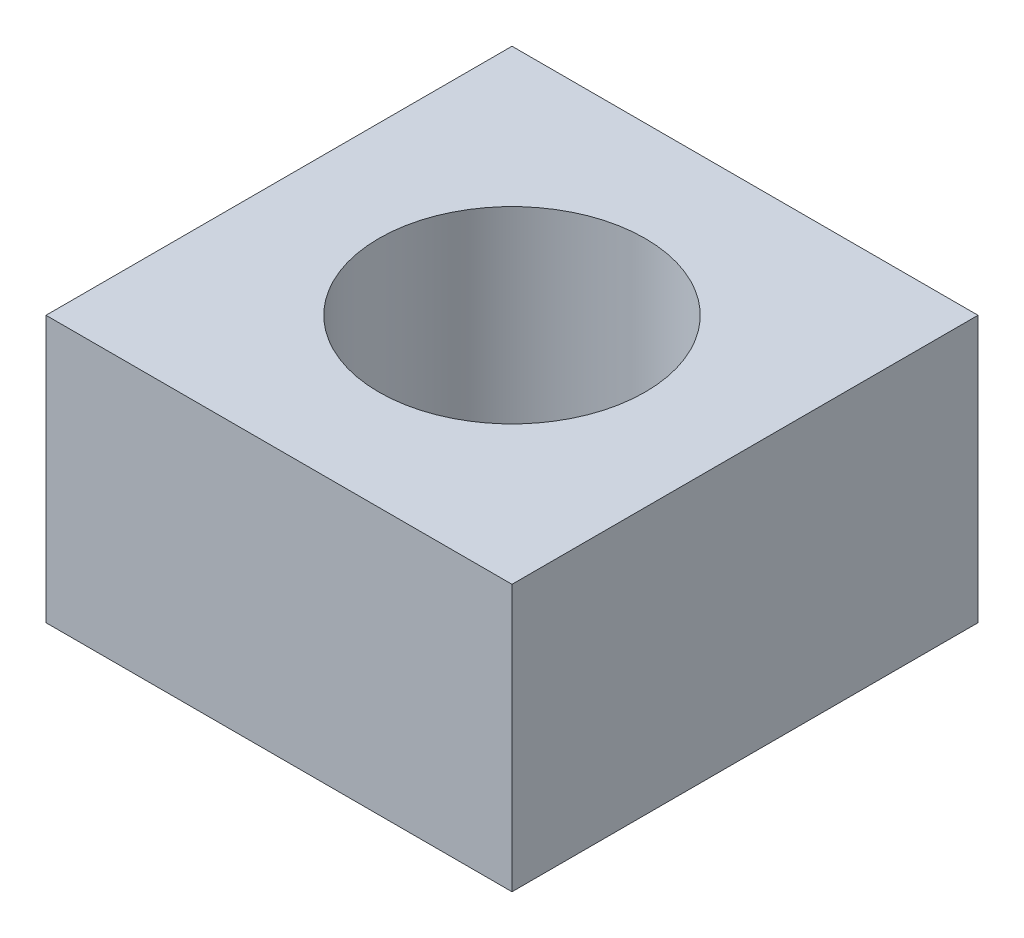
from build123d import *

# Parameters (mm, degrees)
SKETCH1_W           = 7
SKETCH1_H           = 7
SKETCH1_R           = 2
BOSS_EXTRUDE1_DEPTH = 4


with BuildPart() as part:
    # Sketch1 → Boss-Extrude1 (new body)
    with BuildSketch(Plane(origin=(0, 0, 0), x_dir=(1, 0, 0), z_dir=(0, 1, 0))):
        Rectangle(SKETCH1_W, SKETCH1_H)
        with Locations(Location((0, 0, 0), (0, 0, 270))):
            Circle(SKETCH1_R, mode=Mode.SUBTRACT)
    extrude(amount=BOSS_EXTRUDE1_DEPTH)


solid = part.part
